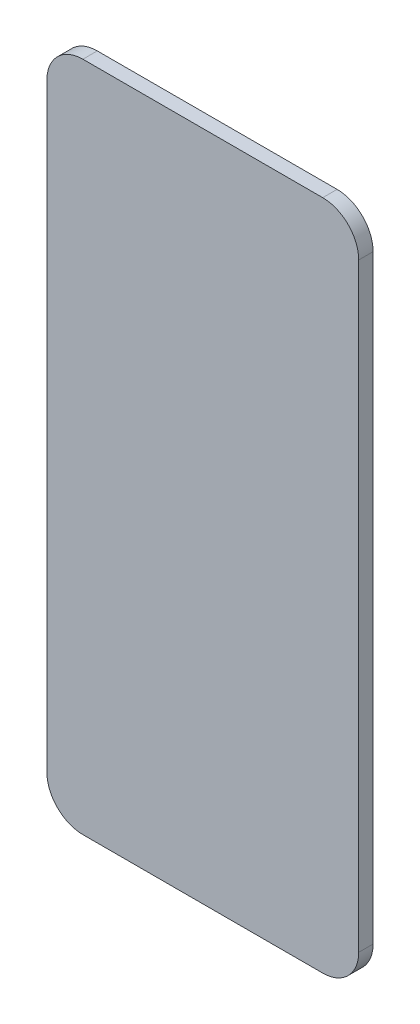
from build123d import *

# Parameters (mm, degrees)
SKETCH1_W           = 26
SKETCH1_H           = 56
BOSS_EXTRUDE1_DEPTH = 1.2
FILLET1_R           = 3


with BuildPart() as part:
    # Sketch1 → Boss-Extrude1 (new body)
    with BuildSketch(Plane.XY):
        Rectangle(SKETCH1_W, SKETCH1_H)
    extrude(amount=BOSS_EXTRUDE1_DEPTH)

    # Fillet1
    fillet1_edges = [part.edges().sort_by_distance(p)[0] for p in [
        (-13, 28, 0.6),
        (13, 28, 0.6),
        (13, -28, 0.6),
        (-13, -28, 0.6),
    ]]
    fillet(fillet1_edges, radius=FILLET1_R)


solid = part.part
